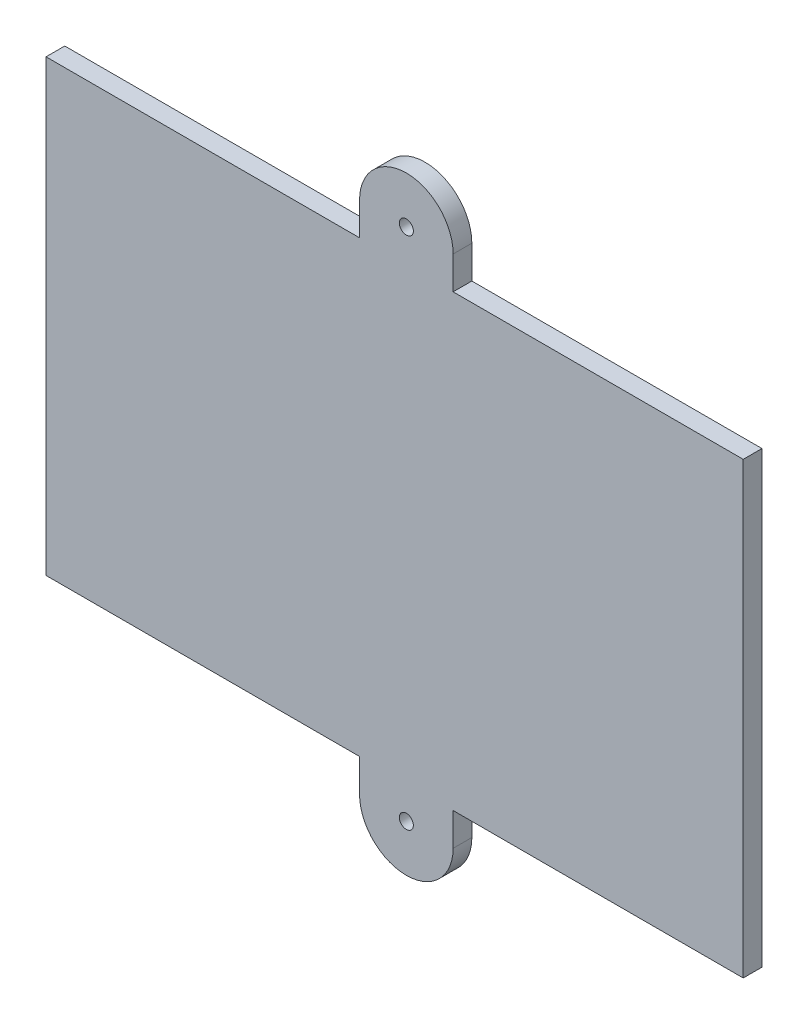
from build123d import *

# Parameters (mm, degrees)
SKETCH1_R           = 1.5
BOSS_EXTRUDE1_DEPTH = 4


with BuildPart() as part:
    # Sketch1 → Boss-Extrude1 (new body)
    with BuildSketch(Plane.XY):
        with BuildLine():
            Line((0, 0), (0, -96))
            Line((0, -96), (67, -96))
            Line((67, -96), (67, -103))
            ThreePointArc((67, -103), (77, -113), (87, -103))
            Line((87, -103), (87, -96))
            Line((87, -96), (149, -96))
            Line((149, -96), (149, 0))
            Line((149, 0), (87, 0))
            Line((87, 0), (87, 7))
            ThreePointArc((87, 7), (77, 17), (67, 7))
            Line((67, 7), (67, 0))
            Line((67, 0), (0, 0))
        make_face()
        with Locations((77, -103)):
            Circle(SKETCH1_R, mode=Mode.SUBTRACT)
        with Locations((77, 7)):
            Circle(SKETCH1_R, mode=Mode.SUBTRACT)
    extrude(amount=BOSS_EXTRUDE1_DEPTH)


solid = part.part
